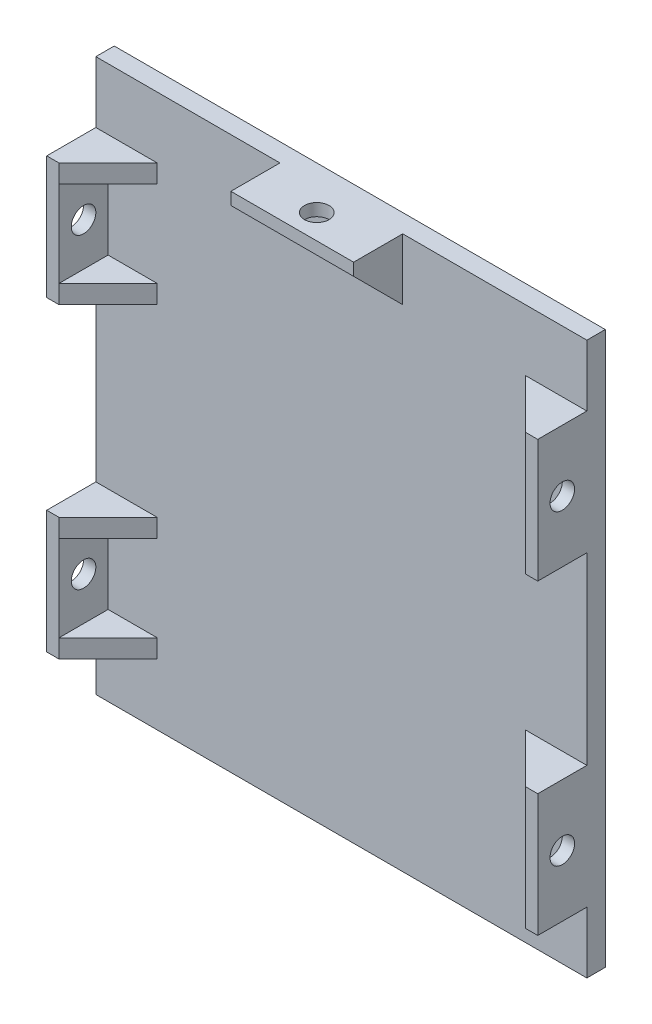
from build123d import *

# Parameters (mm, degrees)
SKETCH1_W               = 80
SKETCH1_H               = 90
BOSS_EXTRUDE1_DEPTH     = 3
BOSS_EXTRUDE2_DEPTH     = 8
CUT_EXTRUDE1_DEPTH      = 114.670576668
SKETCH6_R               = 2
CUT_EXTRUDE3_DEPTH      = 25
MIRROR5_COPY_1_DEPTH    = 8
MIRROR5_COPY_2_DEPTH    = 114.670576668
MIRROR5_COPY_3_SKETCH_R = 2
MIRROR5_COPY_3_DEPTH    = 25
BOSS_EXTRUDE3_DEPTH     = 8
CUT_EXTRUDE2_DEPTH      = 25
SKETCH7_R               = 2
CUT_EXTRUDE4_DEPTH      = 25


with BuildPart() as part:
    # Sketch1 → Boss-Extrude1 (new body)
    with BuildSketch(Plane.XY):
        with Locations((40, 45)):
            Rectangle(SKETCH1_W, SKETCH1_H)
    extrude(amount=BOSS_EXTRUDE1_DEPTH)

    # Sketch2 → Boss-Extrude2 (add)
    with BuildSketch(Plane.XY.offset(3)):
        Polygon((0, 80), (10, 80), (10, 77), (2, 77), (2, 63), (10, 63), (10, 60), (0, 60), align=None)
    boss_extrude2 = extrude(amount=BOSS_EXTRUDE2_DEPTH)

    # Sketch3 → Cut-Extrude1 (cut, through all)
    with BuildSketch(Plane(origin=(0, 80, 0), x_dir=(1, 0, 0), z_dir=(0, 1, 0))):
        Polygon((10, -3), (2, -11), (10, -11), align=None)
    cut_extrude1 = extrude(amount=-CUT_EXTRUDE1_DEPTH, mode=Mode.SUBTRACT)

    # Sketch6 → Cut-Extrude3 (cut)
    with BuildSketch(Plane(origin=(2, 0, 0), x_dir=(0, 0, -1), z_dir=(1, 0, 0))):
        with Locations(Location((-7, 70, 0), (0, 0, 90))):
            Circle(SKETCH6_R)
    cut_extrude3 = extrude(amount=-CUT_EXTRUDE3_DEPTH, mode=Mode.SUBTRACT)

    # Mirror4: Boss-Extrude2, Cut-Extrude1, Cut-Extrude3 across plane
    add(boss_extrude2.mirror(Plane(origin=(40, 0, 0), x_dir=(0, 0, 1), z_dir=(1, 0, 0))))
    add(cut_extrude1.mirror(Plane(origin=(40, 0, 0), x_dir=(0, 0, 1), z_dir=(1, 0, 0))), mode=Mode.SUBTRACT)
    add(cut_extrude3.mirror(Plane(origin=(40, 0, 0), x_dir=(0, 0, 1), z_dir=(1, 0, 0))), mode=Mode.SUBTRACT)

    # Mirror5: Boss-Extrude2, Cut-Extrude1, Cut-Extrude3 across plane
    add(boss_extrude2.mirror(Plane(origin=(0, 45, 0), x_dir=(0, 0, 1), z_dir=(0, -1, 0))))
    add(cut_extrude1.mirror(Plane(origin=(0, 45, 0), x_dir=(0, 0, 1), z_dir=(0, -1, 0))), mode=Mode.SUBTRACT)
    add(cut_extrude3.mirror(Plane(origin=(0, 45, 0), x_dir=(0, 0, 1), z_dir=(0, -1, 0))), mode=Mode.SUBTRACT)

    # Mirror5 copy 1 sketch → Mirror5 copy 1 (add)
    with BuildSketch(Plane(origin=(80, 90, 3), x_dir=(-1, 0, 0), z_dir=(0, 0, 1))):
        Polygon((0, 80), (10, 80), (10, 77), (2, 77), (2, 63), (10, 63), (10, 60), (0, 60), align=None)
    extrude(amount=MIRROR5_COPY_1_DEPTH)

    # Mirror5 copy 2 sketch → Mirror5 copy 2 (cut, through all)
    with BuildSketch(Plane(origin=(80, 10, 0), x_dir=(-1, 0, 0), z_dir=(0, -1, 0))):
        Polygon((10, -3), (2, -11), (10, -11), align=None)
    extrude(amount=-MIRROR5_COPY_2_DEPTH, mode=Mode.SUBTRACT)

    # Mirror5 copy 3 sketch → Mirror5 copy 3 (cut)
    with BuildSketch(Plane(origin=(78, 90, 0), x_dir=(0, 0, -1), z_dir=(-1, 0, 0))):
        with Locations(Location((-7, 70, 0), (0, 0, 90))):
            Circle(MIRROR5_COPY_3_SKETCH_R)
    extrude(amount=-MIRROR5_COPY_3_DEPTH, mode=Mode.SUBTRACT)

    # Sketch4 → Boss-Extrude3 (add)
    with BuildSketch(Plane.XY.offset(3)):
        Polygon((30, 90), (50, 90), (50, 80), (47, 80), (47, 88), (33, 88), (33, 80), (30, 80), align=None)
    extrude(amount=BOSS_EXTRUDE3_DEPTH)

    # Sketch5 → Cut-Extrude2 (cut)
    with BuildSketch(Plane.ZY.offset(-30)):
        Polygon((3, 80), (11, 88), (11, 80), align=None)
    extrude(amount=-CUT_EXTRUDE2_DEPTH, mode=Mode.SUBTRACT)

    # Sketch7 → Cut-Extrude4 (cut)
    with BuildSketch(Plane.XZ.offset(-88)):
        with Locations(Location((40, 7, 0), (0, 0, 270))):
            Circle(SKETCH7_R)
    extrude(amount=-CUT_EXTRUDE4_DEPTH, mode=Mode.SUBTRACT)


solid = part.part
